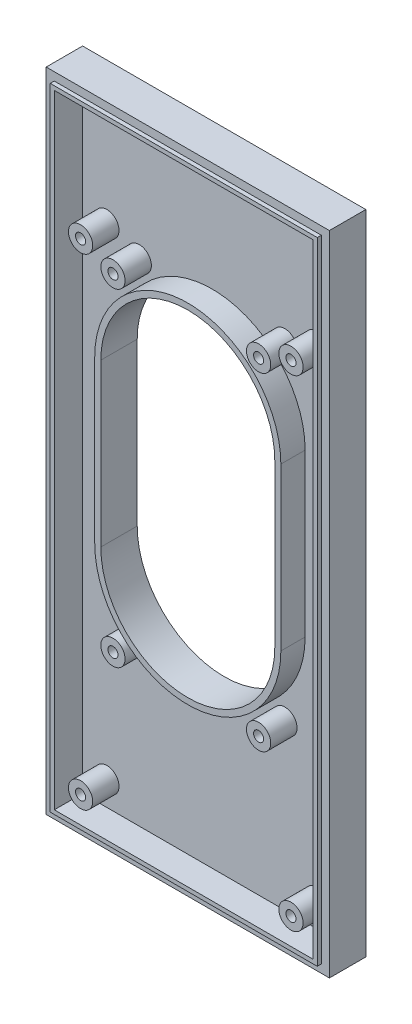
from build123d import *

# Parameters (mm, degrees)
CROQUIS1_W              = 70
CROQUIS1_H              = 160
SALIENTE_EXTRUIR1_DEPTH = 10
VACIADO1_T              = -3
CROQUIS2_W              = 70
CROQUIS2_H              = 160
CROQUIS2_W_2            = 66
CROQUIS2_H_2            = 156
CORTAR_EXTRUIR1_DEPTH   = 1
SALIENTE_EXTRUIR2_DEPTH = 6
CORTAR_EXTRUIR2_START   = -6
CORTAR_EXTRUIR2_DEPTH   = 6
CROQUIS5_R              = 3
CROQUIS5_R_2            = 1.25
SALIENTE_EXTRUIR3_DEPTH = 6.5
CROQUIS6_R              = 3
CROQUIS6_R_2            = 1.25
SALIENTE_EXTRUIR4_DEPTH = 6.5


with BuildPart() as part:
    # Croquis1 → Saliente-Extruir1 (new body)
    with BuildSketch(Plane.XY):
        with Locations((35, 80)):
            Rectangle(CROQUIS1_W, CROQUIS1_H)
    extrude(amount=-SALIENTE_EXTRUIR1_DEPTH)

    # Vaciado1
    vaciado1_openings = [part.faces().sort_by_distance(p)[0] for p in [
        (35, 80, 0),
    ]]
    offset(amount=VACIADO1_T, openings=vaciado1_openings, kind=Kind.INTERSECTION)

    # Croquis2 → Cortar-Extruir1 (cut)
    with BuildSketch(Plane.XY):
        with Locations((35, 80)):
            Rectangle(CROQUIS2_W, CROQUIS2_H)
        with Locations((35, 80)):
            Rectangle(CROQUIS2_W_2, CROQUIS2_H_2, mode=Mode.SUBTRACT)
    extrude(amount=-CORTAR_EXTRUIR1_DEPTH, mode=Mode.SUBTRACT)

    # Croquis3 → Saliente-Extruir2 (add)
    with BuildSketch(Plane.XY.offset(-7)):
        with BuildLine():
            Line((58, 104), (58, 64))
            ThreePointArc((58, 64), (35, 41), (12, 64))
            Line((12, 64), (12, 104))
            ThreePointArc((12, 104), (35, 127), (58, 104))
        make_face()
        with BuildLine():
            Line((56.5, 104), (56.5, 64))
            ThreePointArc((56.5, 64), (35, 42.5), (13.5, 64))
            Line((13.5, 64), (13.5, 104))
            ThreePointArc((13.5, 104), (35, 125.5), (56.5, 104))
        make_face(mode=Mode.SUBTRACT)
    extrude(amount=SALIENTE_EXTRUIR2_DEPTH)

    # Croquis4 → Cortar-Extruir2 (cut)
    with BuildSketch(Plane.XY.offset(-7).offset(CORTAR_EXTRUIR2_START)):
        with BuildLine():
            Line((56.5, 104), (56.5, 64))
            ThreePointArc((56.5, 64), (35, 42.5), (13.5, 64))
            Line((13.5, 64), (13.5, 104))
            ThreePointArc((13.5, 104), (35, 125.5), (56.5, 104))
        make_face()
    extrude(amount=CORTAR_EXTRUIR2_DEPTH, mode=Mode.SUBTRACT)

    # Croquis5 → Saliente-Extruir3 (add)
    # profile 1 of 4: a face of its own
    with BuildSketch(Plane.XY.offset(-7)):
        with Locations(Location((17, 124.5, 0), (0, 0, 180))):
            Circle(CROQUIS5_R)
        with Locations(Location((17, 124.5, 0), (0, 0, 180))):
            Circle(CROQUIS5_R_2, mode=Mode.SUBTRACT)
    # profile 2 of 4: a face of its own
    with BuildSketch(Plane.XY.offset(-7)):
        with Locations(Location((53, 124.5, 0), (0, 0, 180))):
            Circle(CROQUIS5_R)
        with Locations(Location((53, 124.5, 0), (0, 0, 180))):
            Circle(CROQUIS5_R_2, mode=Mode.SUBTRACT)
    # profile 3 of 4: a face of its own
    with BuildSketch(Plane.XY.offset(-7)):
        with Locations(Location((17, 43.5, 0), (0, 0, 180))):
            Circle(CROQUIS5_R)
        with Locations(Location((17, 43.5, 0), (0, 0, 180))):
            Circle(CROQUIS5_R_2, mode=Mode.SUBTRACT)
    # profile 4 of 4: a face of its own
    with BuildSketch(Plane.XY.offset(-7)):
        with Locations(Location((53, 43.5, 0), (0, 0, 180))):
            Circle(CROQUIS5_R)
        with Locations(Location((53, 43.5, 0), (0, 0, 180))):
            Circle(CROQUIS5_R_2, mode=Mode.SUBTRACT)
    extrude(amount=SALIENTE_EXTRUIR3_DEPTH)

    # Croquis6 → Saliente-Extruir4 (add)
    # profile 1 of 4: a face of its own
    with BuildSketch(Plane.XY.offset(-7)):
        with Locations(Location((9, 9, 0), (0, 0, 180))):
            Circle(CROQUIS6_R)
        with Locations(Location((9, 9, 0), (0, 0, 180))):
            Circle(CROQUIS6_R_2, mode=Mode.SUBTRACT)
    # profile 2 of 4: a face of its own
    with BuildSketch(Plane.XY.offset(-7)):
        with Locations(Location((61, 9, 0), (0, 0, 180))):
            Circle(CROQUIS6_R)
        with Locations(Location((61, 9, 0), (0, 0, 180))):
            Circle(CROQUIS6_R_2, mode=Mode.SUBTRACT)
    # profile 3 of 4: a face of its own
    with BuildSketch(Plane.XY.offset(-7)):
        with Locations(Location((9, 128, 0), (0, 0, 180))):
            Circle(CROQUIS6_R)
        with Locations(Location((9, 128, 0), (0, 0, 180))):
            Circle(CROQUIS6_R_2, mode=Mode.SUBTRACT)
    # profile 4 of 4: a face of its own
    with BuildSketch(Plane.XY.offset(-7)):
        with Locations(Location((61, 128, 0), (0, 0, 180))):
            Circle(CROQUIS6_R)
        with Locations(Location((61, 128, 0), (0, 0, 180))):
            Circle(CROQUIS6_R_2, mode=Mode.SUBTRACT)
    extrude(amount=SALIENTE_EXTRUIR4_DEPTH)


solid = part.part
